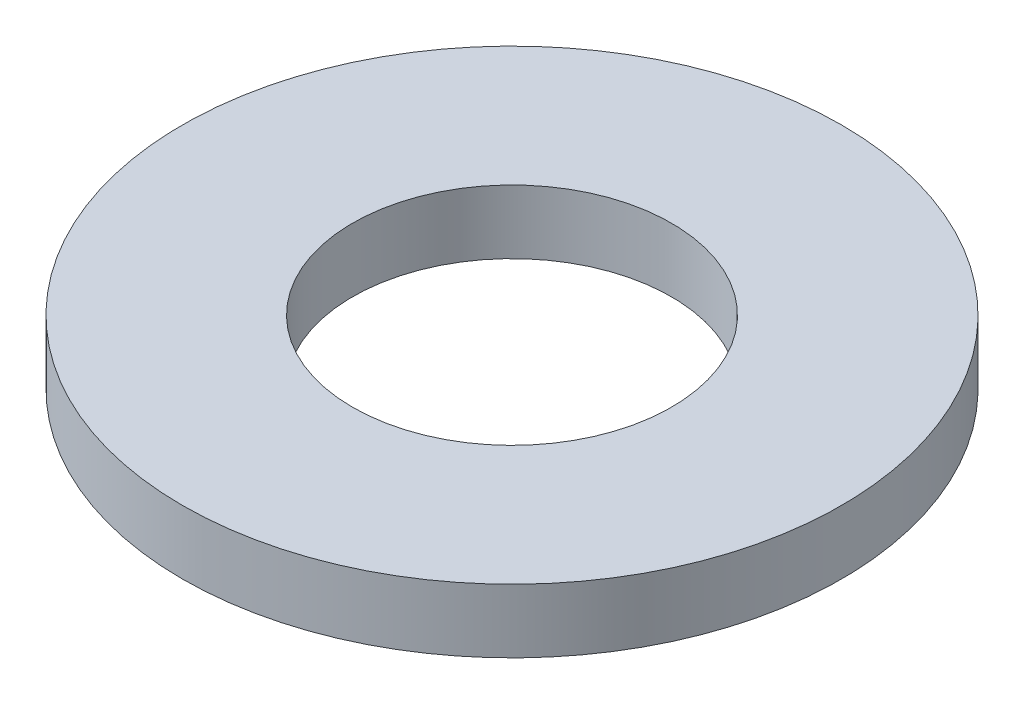
from build123d import *

# Parameters (mm, degrees)
SKETCH1_R           = 31
SKETCH1_R_2         = 15
BOSS_EXTRUDE1_DEPTH = 3


with BuildPart() as part:
    # Sketch1 → Boss-Extrude1 (new, symmetric)
    with BuildSketch(Plane(origin=(0, 0, 0), x_dir=(1, 0, 0), z_dir=(0, 1, 0))):
        with Locations(Location((0, 0, 0), (0, 0, 270))):
            Circle(SKETCH1_R)
        with Locations(Location((0, 0, 0), (0, 0, 270))):
            Circle(SKETCH1_R_2, mode=Mode.SUBTRACT)
    extrude(amount=BOSS_EXTRUDE1_DEPTH, both=True)


solid = part.part
